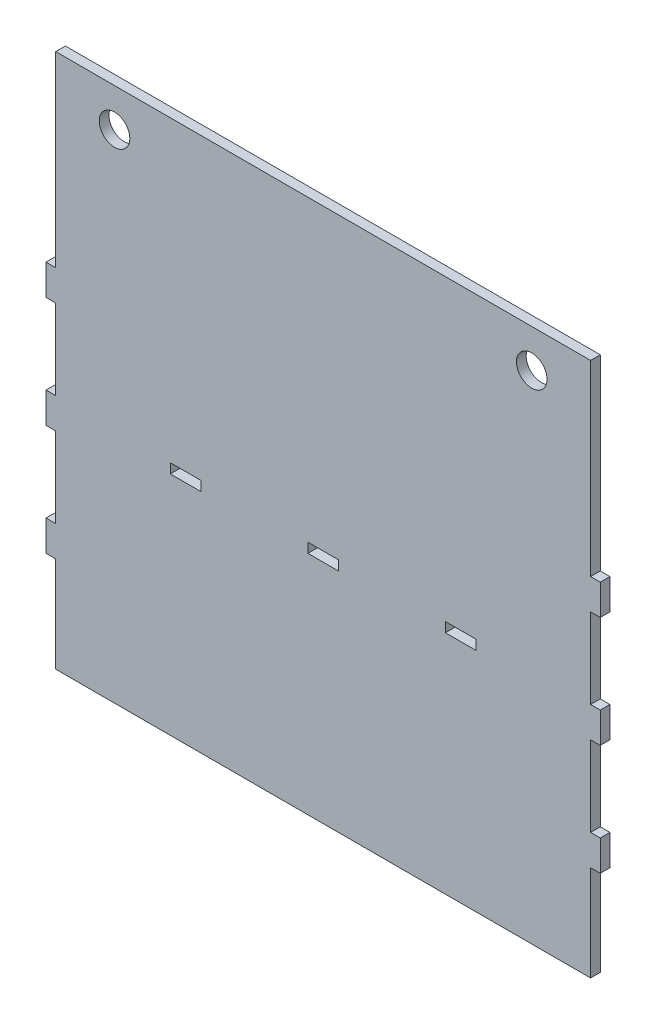
from build123d import *

# Parameters (mm, degrees)
CROQUIS1_W              = 350
CROQUIS1_H              = 350
SALIENTE_EXTRUIR1_DEPTH = 6.35
CROQUIS2_W              = 6.35
CROQUIS2_H              = 20
SALIENTE_EXTRUIR2_DEPTH = 6.35
CROQUIS3_W              = 20
CROQUIS3_H              = 6.35
CORTAR_EXTRUIR1_DEPTH   = 10
CROQUIS4_R              = 10
CORTAR_EXTRUIR2_DEPTH   = 253.097491062


with BuildPart() as part:
    # Croquis1 → Saliente-Extruir1 (new body)
    with BuildSketch(Plane.XY):
        Rectangle(CROQUIS1_W, CROQUIS1_H)
    extrude(amount=SALIENTE_EXTRUIR1_DEPTH)

    # Croquis2 → Saliente-Extruir2 (add)
    with BuildSketch(Plane.ZY.offset(175)):
        with Locations((3.175, 42.5)):
            Rectangle(CROQUIS2_W, CROQUIS2_H)
        with Locations((3.175, -30)):
            Rectangle(CROQUIS2_W, CROQUIS2_H)
        with Locations((3.175, -102.5)):
            Rectangle(CROQUIS2_W, CROQUIS2_H)
    saliente_extruir2 = extrude(amount=SALIENTE_EXTRUIR2_DEPTH)

    # Simetría1: Saliente-Extruir2 across plane
    add(saliente_extruir2.mirror(Plane(origin=(0, 0, 0), x_dir=(0, 0, 1), z_dir=(1, 0, 0))))

    # Croquis3 → Cortar-Extruir1 (cut)
    with BuildSketch(Plane.XY.offset(6.35)):
        with Locations((0, -23.665)):
            Rectangle(CROQUIS3_W, CROQUIS3_H)
        with Locations((90, -23.665)):
            Rectangle(CROQUIS3_W, CROQUIS3_H)
        with Locations((-90, -23.665)):
            Rectangle(CROQUIS3_W, CROQUIS3_H)
    extrude(amount=-CORTAR_EXTRUIR1_DEPTH, mode=Mode.SUBTRACT)

    # Croquis4 → Cortar-Extruir2 (cut, through all)
    with BuildSketch(Plane.XY.offset(6.35)):
        with Locations((-136.525, 150)):
            Circle(CROQUIS4_R)
        with Locations((136.525, 150)):
            Circle(CROQUIS4_R)
    extrude(amount=-CORTAR_EXTRUIR2_DEPTH, mode=Mode.SUBTRACT)


solid = part.part
